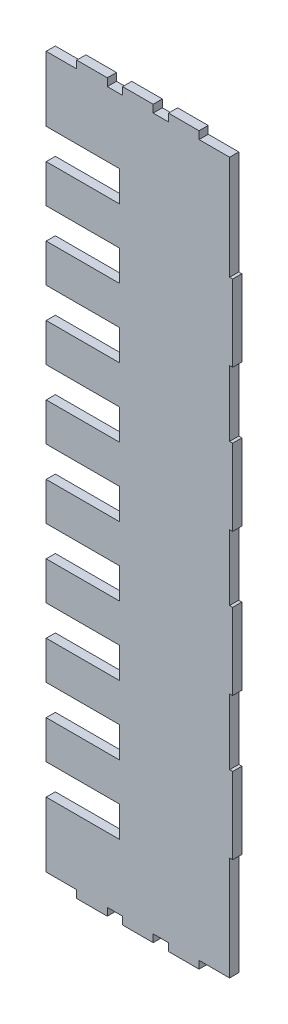
from build123d import *

# Parameters (mm, degrees)
SKETCH1_W           = 120
SKETCH1_H           = 465
BOSS_EXTRUDE1_DEPTH = 6
SKETCH2_W           = 30
SKETCH2_H           = 20
CUT_EXTRUDE1_DEPTH  = 8
SKETCH4_W           = 20
SKETCH4_H           = 10
SKETCH4_W_2         = 4
SKETCH4_H_2         = 50
BOSS_EXTRUDE2_DEPTH = 6
SKETCH5_W           = 18
SKETCH5_H           = 20
CUT_EXTRUDE2_DEPTH  = 10


with BuildPart() as part:
    # Sketch1 → Boss-Extrude1 (new body)
    with BuildSketch(Plane.XY):
        Rectangle(SKETCH1_W, SKETCH1_H)
    extrude(amount=BOSS_EXTRUDE1_DEPTH)

    # Sketch2 → Cut-Extrude1 (cut)
    with BuildSketch(Plane.XY.offset(6)):
        Polygon((-12, 190), (-42, 190), (-42, 180), (-42, 170), (-12, 170), align=None)
        Polygon((-12, 145), (-42, 145), (-42, 135), (-42, 125), (-12, 125), align=None)
        with Locations((-27, 90)):
            Rectangle(SKETCH2_W, SKETCH2_H)
        with Locations((-27, 45)):
            Rectangle(SKETCH2_W, SKETCH2_H)
        with Locations((-27, 0)):
            Rectangle(SKETCH2_W, SKETCH2_H)
        with Locations((-27, -45)):
            Rectangle(SKETCH2_W, SKETCH2_H)
        with Locations((-27, -90)):
            Rectangle(SKETCH2_W, SKETCH2_H)
        with Locations((-27, -135)):
            Rectangle(SKETCH2_W, SKETCH2_H)
        with Locations((-27, -180)):
            Rectangle(SKETCH2_W, SKETCH2_H)
    extrude(amount=-CUT_EXTRUDE1_DEPTH, mode=Mode.SUBTRACT)

    # Sketch4 → Boss-Extrude2 (add)
    with BuildSketch(Plane.XY.offset(6)):
        with Locations((-30, 232.5)):
            Rectangle(SKETCH4_W, SKETCH4_H)
        with Locations((0, 232.5)):
            Rectangle(SKETCH4_W, SKETCH4_H)
        with Locations((30, 232.5)):
            Rectangle(SKETCH4_W, SKETCH4_H)
        with Locations((-30, -232.5)):
            Rectangle(SKETCH4_W, SKETCH4_H)
        with Locations((0, -232.5)):
            Rectangle(SKETCH4_W, SKETCH4_H)
        with Locations((30, -232.5)):
            Rectangle(SKETCH4_W, SKETCH4_H)
        with Locations((60, 139.5)):
            Rectangle(SKETCH4_W_2, SKETCH4_H_2)
        with Locations((60, 46.5)):
            Rectangle(SKETCH4_W_2, SKETCH4_H_2)
        with Locations((60, -46.5)):
            Rectangle(SKETCH4_W_2, SKETCH4_H_2)
        with Locations((60, -139.5)):
            Rectangle(SKETCH4_W_2, SKETCH4_H_2)
    extrude(amount=-BOSS_EXTRUDE2_DEPTH)

    # Sketch5 → Cut-Extrude2 (cut)
    with BuildSketch(Plane.XY.offset(6)):
        with Locations((-51, 180)):
            Rectangle(SKETCH5_W, SKETCH5_H)
        with Locations((-51, 135)):
            Rectangle(SKETCH5_W, SKETCH5_H)
        with Locations((-51, 90)):
            Rectangle(SKETCH5_W, SKETCH5_H)
        with Locations((-51, 45)):
            Rectangle(SKETCH5_W, SKETCH5_H)
        with Locations((-51, 0)):
            Rectangle(SKETCH5_W, SKETCH5_H)
        with Locations((-51, -45)):
            Rectangle(SKETCH5_W, SKETCH5_H)
        with Locations((-51, -90)):
            Rectangle(SKETCH5_W, SKETCH5_H)
        with Locations((-51, -135)):
            Rectangle(SKETCH5_W, SKETCH5_H)
        with Locations((-51, -180)):
            Rectangle(SKETCH5_W, SKETCH5_H)
    extrude(amount=-CUT_EXTRUDE2_DEPTH, mode=Mode.SUBTRACT)


solid = part.part
